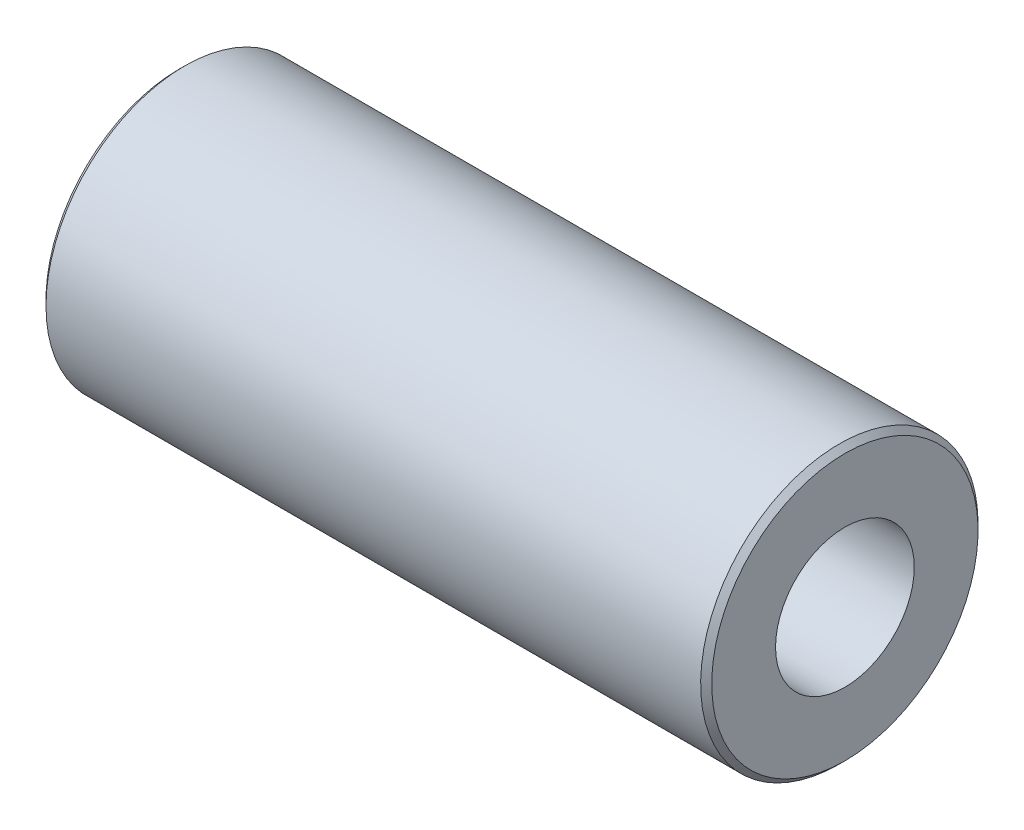
from build123d import *

# Parameters (mm, degrees)
SKETCH_1_W     = 12
SKETCH_1_H     = 2.5
CHAMFER_1_SIZE = 0.1


with BuildPart() as part:
    # 草图1 → 旋转1 (revolve)
    with BuildSketch(Plane.XY, mode=Mode.PRIVATE) as revolve_1_sk:
        with Locations((0, 1.25)):
            Rectangle(SKETCH_1_W, SKETCH_1_H)
    revolve(revolve_1_sk.sketch.rotate(Axis((-6, 0, 0), (1, 0, 0)), 180), axis=Axis((-6, 0, 0), (1, 0, 0)))

    # 草图3 → Hole Wizard 378 (revolve, cut)
    with BuildSketch(Plane(origin=(-6, 0, 0), x_dir=(0, 0, 1), z_dir=(0, 1, 0))):
        Polygon((0, 0), (0, 10.751075774), (1.25, 10), (1.25, 0), align=None)
    hole_wizard_378 = revolve(axis=Axis((-12.35, 0, 0), (1, 0, 0)), mode=Mode.SUBTRACT)

    # 镜向1: Hole Wizard 378 across plane
    add(hole_wizard_378.mirror(Plane(origin=(0, 0, 0), x_dir=(0, 0, 1), z_dir=(1, 0, 0))), mode=Mode.SUBTRACT)

    # 倒角1
    chamfer_1_edges = [part.edges().sort_by_distance(p)[0] for p in [
        (-6, 2.5, 0),
        (6, 2.5, 0),
    ]]
    chamfer(chamfer_1_edges, length=CHAMFER_1_SIZE)


solid = part.part
